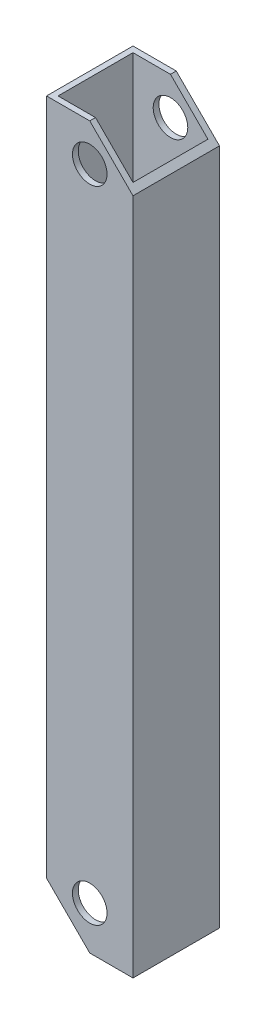
from build123d import *

# Parameters (mm, degrees)
SKETCH_1_W          = 30
SKETCH_1_H          = 30
EXTRUDE_1_DEPTH     = 250
SKETCH_2_W          = 26
SKETCH_2_H          = 26
CUT_EXTRUDE_1_DEPTH = 254.574446662
SKETCH_3_R          = 6
CUT_EXTRUDE_2_DEPTH = 254.574446662
SKETCH_6_R          = 6
CUT_EXTRUDE_4_DEPTH = 254.574446662
CUT_EXTRUDE_5_DEPTH = 254.574446662
CUT_EXTRUDE_6_DEPTH = 254.574446662


with BuildPart() as part:
    # Эскиз1 → Бобышка-Вытянуть1 (new body)
    with BuildSketch(Plane(origin=(0, 0, 0), x_dir=(1, 0, 0), z_dir=(0, 1, 0))):
        with Locations((15, 15)):
            Rectangle(SKETCH_1_W, SKETCH_1_H)
    extrude(amount=EXTRUDE_1_DEPTH)

    # Эскиз2 → Вырез-Вытянуть1 (cut, through all)
    with BuildSketch(Plane(origin=(0, 250, 0), x_dir=(1, 0, 0), z_dir=(0, 1, 0))):
        with Locations((15, 15)):
            Rectangle(SKETCH_2_W, SKETCH_2_H)
    extrude(amount=-CUT_EXTRUDE_1_DEPTH, mode=Mode.SUBTRACT)

    # Эскиз3 → Вырез-Вытянуть2 (cut, through all)
    with BuildSketch(Plane.XY):
        with Locations((15, 15)):
            Circle(SKETCH_3_R)
    extrude(amount=-CUT_EXTRUDE_2_DEPTH, mode=Mode.SUBTRACT)

    # Эскиз6 → Вырез-Вытянуть4 (cut, through all)
    with BuildSketch(Plane.XY):
        with Locations((15, 237)):
            Circle(SKETCH_6_R)
    extrude(amount=-CUT_EXTRUDE_4_DEPTH, mode=Mode.SUBTRACT)

    # Эскиз8 → Вырез-Вытянуть5 (cut, through all)
    with BuildSketch(Plane.XY):
        Polygon((15, 250), (30, 235), (30, 250), align=None)
    extrude(amount=-CUT_EXTRUDE_5_DEPTH, mode=Mode.SUBTRACT)

    # Эскиз9 → Вырез-Вытянуть6 (cut, through all)
    with BuildSketch(Plane.XY):
        Polygon((15, 0), (0, 15), (0, 0), align=None)
    extrude(amount=-CUT_EXTRUDE_6_DEPTH, mode=Mode.SUBTRACT)


solid = part.part
